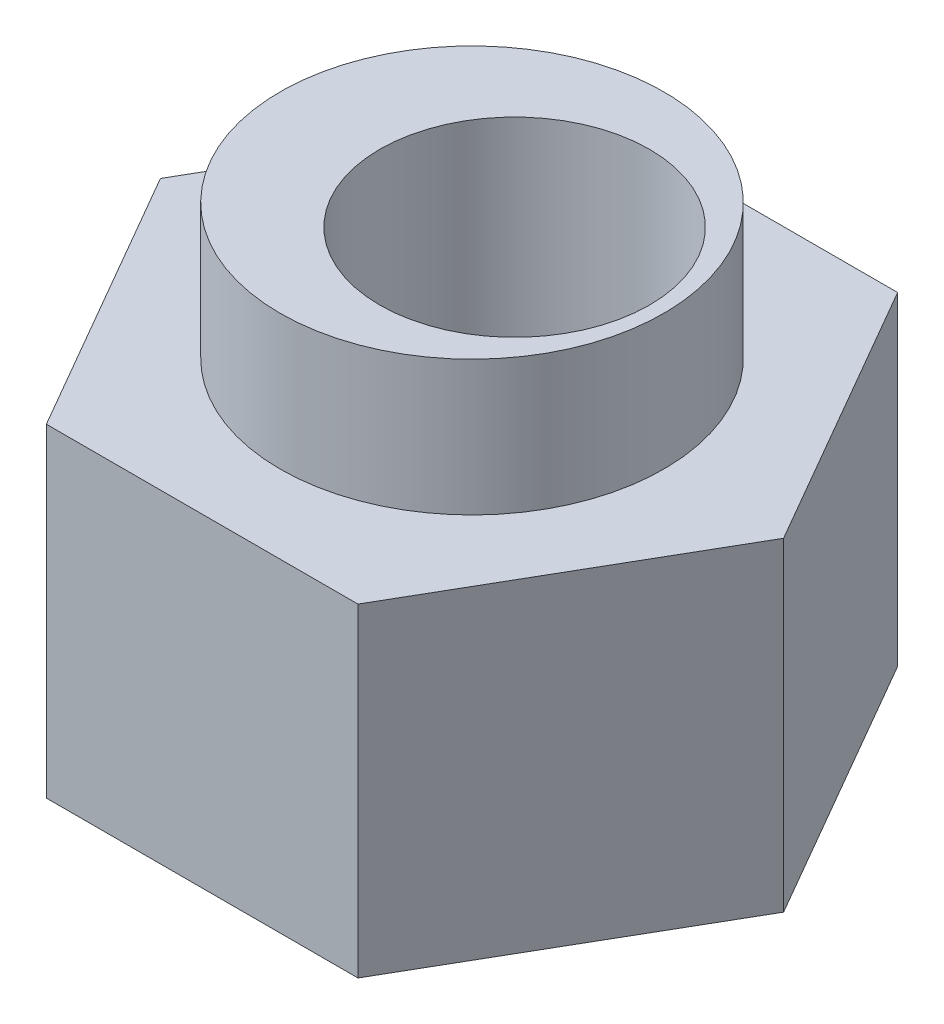
from build123d import *

# Parameters (mm, degrees)
SKETCH_1_R      = 2.5
EXTRUDE_1_DEPTH = 6
EXTRUDE_START   = 2.5
SKETCH_1_3_R    = 3.555
SKETCH_1_3_R_2  = 2.5
EXTRUDE_2_DEPTH = 2.5


with BuildPart() as part:
    # Эскиз1 → Бобышка-Вытянуть1 (new body)
    with BuildSketch(Plane(origin=(0, 0, 0), x_dir=(1, 0, 0), z_dir=(0, 1, 0))):
        Polygon((1.958548395, -2.442501227), (-0.928202951, 2.557498773), (-6.701705643, 2.557498773), (-9.588456989, -2.442501227), (-6.701705643, -7.442501227), (-0.928202951, -7.442501227), align=None)
        with Locations((-3.024954297, -2.442501227)):
            Circle(SKETCH_1_R, mode=Mode.SUBTRACT)
    extrude(amount=-EXTRUDE_1_DEPTH)

    # Эскиз1<3> → Бобышка-Вытянуть2 (add)
    with BuildSketch(Plane(origin=(0, 0, 0), x_dir=(1, 0, 0), z_dir=(0, 1, 0)).offset(EXTRUDE_START)):
        with Locations((-3.814954297, -2.442501227)):
            Circle(SKETCH_1_3_R)
        with Locations((-3.024954297, -2.442501227)):
            Circle(SKETCH_1_3_R_2, mode=Mode.SUBTRACT)
    extrude(amount=-EXTRUDE_2_DEPTH)


solid = part.part
